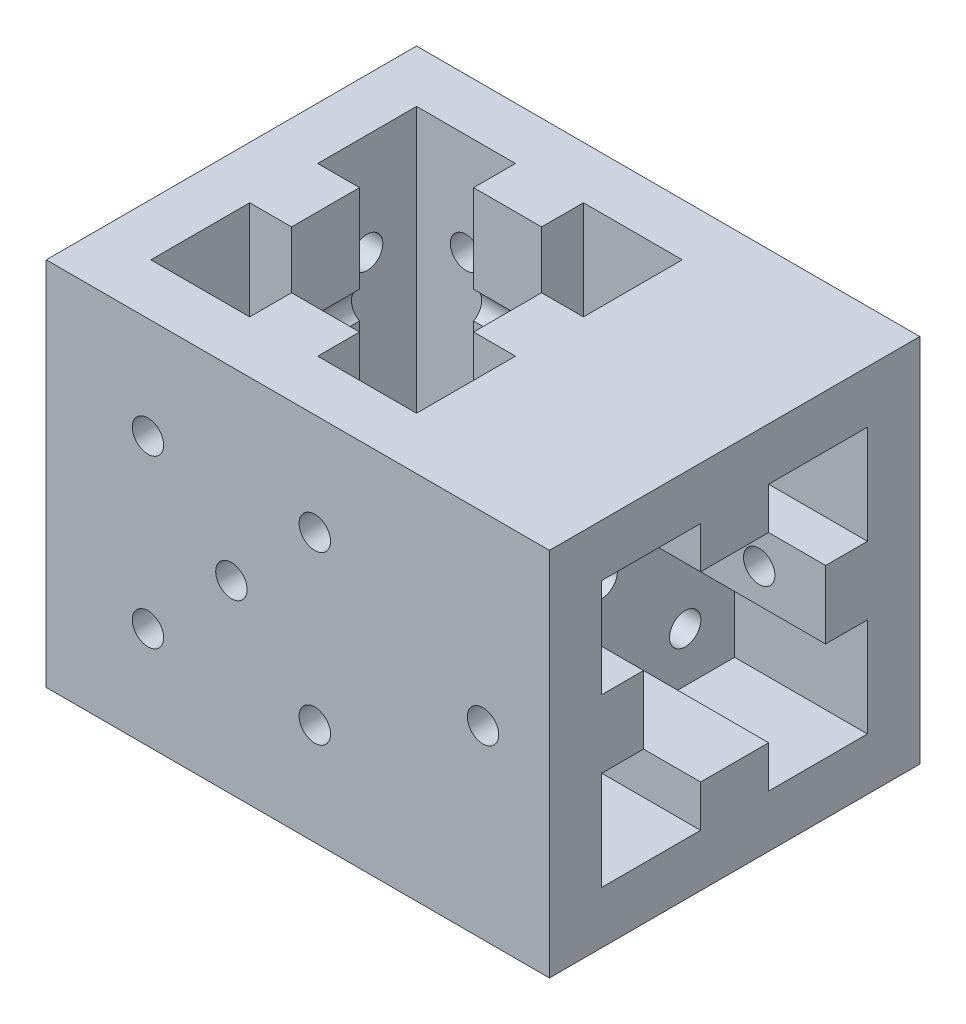
from build123d import *

# Parameters (mm, degrees)
SKETCH1_W           = 35.4
SKETCH1_H           = 35.4
BOSS_EXTRUDE1_DEPTH = 35.4
SKETCH2_W           = 35.4
SKETCH2_H           = 35.4
BOSS_EXTRUDE2_DEPTH = 12.7
SKETCH5_R           = 1.5
CUT_EXTRUDE2_DEPTH  = 54.1
SKETCH6_R           = 1.5
CUT_EXTRUDE3_DEPTH  = 59.570299641


with BuildPart() as part:
    # Sketch1 → Boss-Extrude1 (new body)
    with BuildSketch(Plane(origin=(0, 0, 0), x_dir=(1, 0, 0), z_dir=(0, 1, 0))):
        Rectangle(SKETCH1_W, SKETCH1_H)
        Polygon((12.7, 3.25), (12.7, 12.7), (3.25, 12.7), (3.25, 8.7), (-3.25, 8.7), (-3.25, 12.7), (-12.7, 12.7), (-12.7, 3.25), (-8.7, 3.25), (-8.7, -3.25), (-12.7, -3.25), (-12.7, -12.7), (-3.25, -12.7), (-3.25, -8.7), (3.25, -8.7), (3.25, -12.7), (12.7, -12.7), (12.7, -3.25), (8.7, -3.25), (8.7, 3.25), align=None, mode=Mode.SUBTRACT)
    extrude(amount=BOSS_EXTRUDE1_DEPTH)

    # Sketch2 → Boss-Extrude2 (add)
    with BuildSketch(Plane(origin=(17.7, 0, 0), x_dir=(0, 0, -1), z_dir=(1, 0, 0))):
        with Locations((0, 17.7)):
            Rectangle(SKETCH2_W, SKETCH2_H)
        Polygon((12.7, 20.95), (12.7, 30.4), (3.25, 30.4), (3.25, 26.4), (-3.25, 26.4), (-3.25, 30.4), (-12.7, 30.4), (-12.7, 20.95), (-8.7, 20.95), (-8.7, 14.45), (-12.7, 14.45), (-12.7, 5), (-3.25, 5), (-3.25, 9), (3.25, 9), (3.25, 5), (12.7, 5), (12.7, 14.45), (8.7, 14.45), (8.7, 20.95), align=None, mode=Mode.SUBTRACT)
    extrude(amount=BOSS_EXTRUDE2_DEPTH)

    # Sketch5 → Cut-Extrude2 (cut, through all)
    with BuildSketch(Plane(origin=(17.7, 0, 0), x_dir=(0, 0, -1), z_dir=(1, 0, 0))):
        with Locations((0, 17.7)):
            Circle(SKETCH5_R)
        with Locations((7.975, 9.725)):
            Circle(SKETCH5_R)
        with Locations((-7.975, 9.725)):
            Circle(SKETCH5_R)
        with Locations((-7.975, 25.675)):
            Circle(SKETCH5_R)
        with Locations((7.975, 25.675)):
            Circle(SKETCH5_R)
    extrude(amount=-CUT_EXTRUDE2_DEPTH, mode=Mode.SUBTRACT)

    # Sketch6 → Cut-Extrude3 (cut, through all)
    with BuildSketch(Plane(origin=(0, 0, -17.7), x_dir=(-1, 0, 0), z_dir=(0, 0, -1))):
        with Locations((7.975, 9.725)):
            Circle(SKETCH6_R)
        with Locations((0, 17.7)):
            Circle(SKETCH6_R)
        with Locations((-7.975, 9.725)):
            Circle(SKETCH6_R)
        with Locations((-7.975, 25.675)):
            Circle(SKETCH6_R)
        with Locations((7.975, 25.675)):
            Circle(SKETCH6_R)
        with Locations((-24.05, 17.7)):
            Circle(SKETCH6_R)
    extrude(amount=-CUT_EXTRUDE3_DEPTH, mode=Mode.SUBTRACT)


solid = part.part
